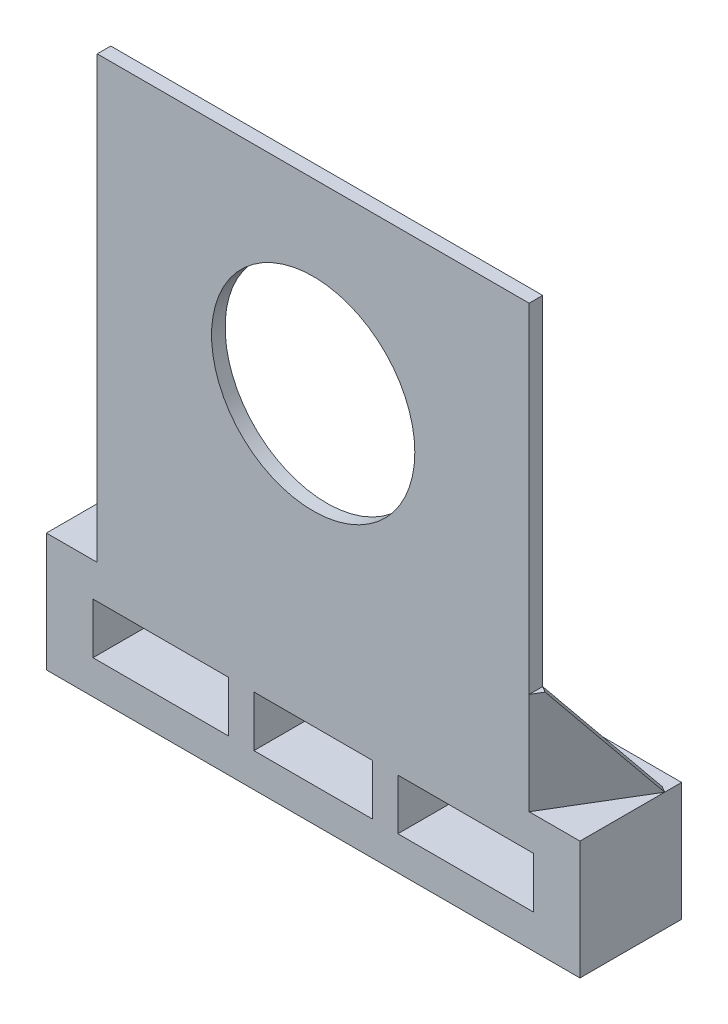
from build123d import *

# Parameters (mm, degrees)
SKETCH1_W           = 255
SKETCH1_H           = 260
SKETCH1_R           = 60
BOSS_EXTRUDE1_DEPTH = 8
SKETCH2_W           = 70
SKETCH2_H           = 30
SKETCH2_W_2         = 80
BOSS_EXTRUDE2_DEPTH = 60
BOSS_EXTRUDE3_DEPTH = 60
CUT_EXTRUDE1_DEPTH  = 60
CUT_EXTRUDE2_DEPTH  = 60


with BuildPart() as part:
    # Sketch1 → Boss-Extrude1 (new body)
    with BuildSketch(Plane.XY):
        Rectangle(SKETCH1_W, SKETCH1_H)
        with Locations((0, 20)):
            Circle(SKETCH1_R, mode=Mode.SUBTRACT)
    extrude(amount=BOSS_EXTRUDE1_DEPTH)

    # Sketch2 → Boss-Extrude2 (add)
    with BuildSketch(Plane.XY.offset(8)):
        Polygon((0, -130), (157.5, -130), (157.5, -200), (-157.5, -200), (-157.5, -130), align=None)
        with Locations((0, -165)):
            Rectangle(SKETCH2_W, SKETCH2_H, mode=Mode.SUBTRACT)
        with Locations((90, -165)):
            Rectangle(SKETCH2_W_2, SKETCH2_H, mode=Mode.SUBTRACT)
        with Locations((-90, -165)):
            Rectangle(SKETCH2_W_2, SKETCH2_H, mode=Mode.SUBTRACT)
    extrude(amount=-BOSS_EXTRUDE2_DEPTH)

    # Sketch3 → Boss-Extrude3 (add)
    with BuildSketch(Plane(origin=(0, -130, 0), x_dir=(1, 0, 0), z_dir=(0, 1, 0))):
        Polygon((127.5, -8), (157.5, 42), (153.970588235, 44.117647059), (127.5, 0), align=None)
    boss_extrude3 = extrude(amount=BOSS_EXTRUDE3_DEPTH)

    # Sketch4 → Cut-Extrude1 (cut)
    with BuildSketch(Plane(origin=(97.279411765, 0, 58.367647059), x_dir=(0.5144957554275268, 0, -0.8574929257125441), z_dir=(0.8574929257125441, 0, 0.5144957554275268))):
        Polygon((65.598208817, -70), (117.04778436, -130), (117.04778436, -70), align=None)
    extrude(amount=-CUT_EXTRUDE1_DEPTH, mode=Mode.SUBTRACT)

    # Mirror4: Boss-Extrude3 across plane
    add(boss_extrude3.mirror(Plane(origin=(0, 0, 0), x_dir=(0, 0, 1), z_dir=(1, 0, 0))))

    # Sketch5 → Cut-Extrude2 (cut)
    with BuildSketch(Plane(origin=(-97.279411765, 0, 58.367647059), x_dir=(0.514495755427527, 0, 0.857492925712544), z_dir=(-0.857492925712544, 0, 0.514495755427527))):
        Polygon((-65.598208817, -70), (-117.04778436, -130), (-117.04778436, -70), align=None)
    extrude(amount=-CUT_EXTRUDE2_DEPTH, mode=Mode.SUBTRACT)


solid = part.part
